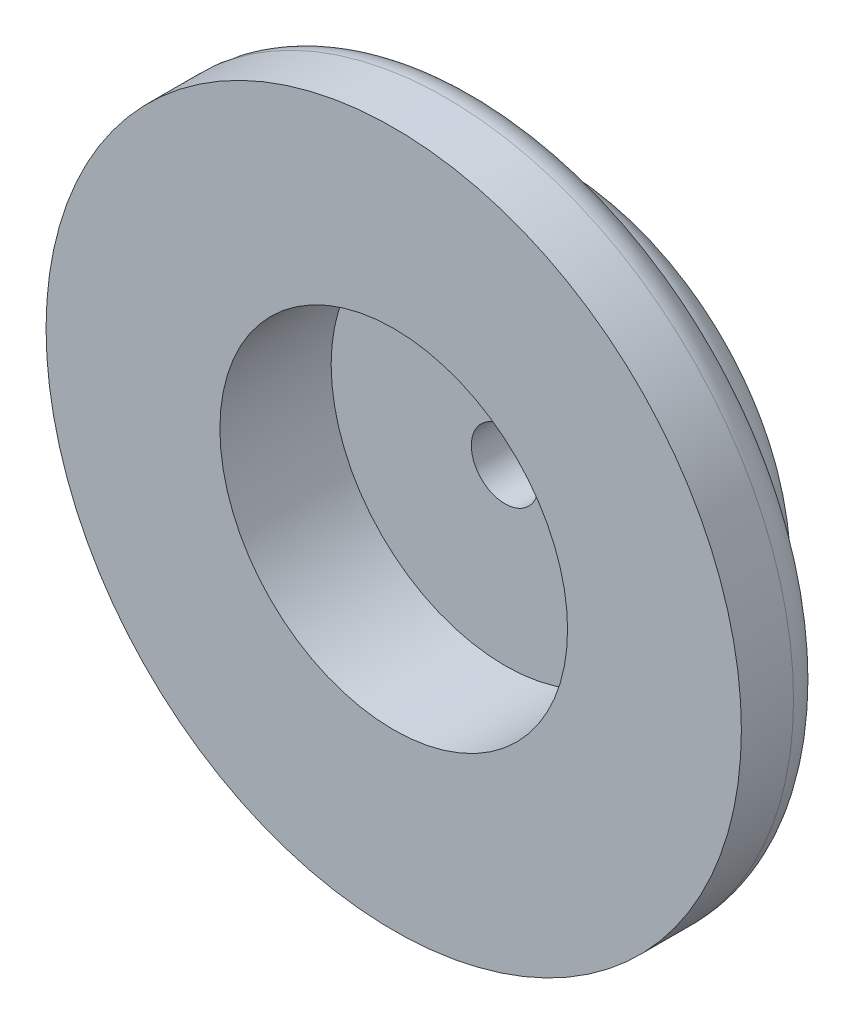
from build123d import *

# Parameters (mm, degrees)
FILLET1_R                        = 2.54
F_10_0_1935_DIAMETER_HOLE1_D     = 4.9149
F_10_0_1935_DIAMETER_HOLE1_DEPTH = 10.16
F_10_0_1935_DIAMETER_HOLE1_TIP   = 1.476584928


with BuildPart() as part:
    # Sketch1 → Revolve1 (revolve)
    with BuildSketch(Plane(origin=(0, 0, 0), x_dir=(0, 0, -1), z_dir=(1, 0, 0)), mode=Mode.PRIVATE) as revolve1_sk:
        Polygon((79.248, 12.7), (79.248, 25.4), (85.598, 25.4), (85.598, 17.78), (91.948, 17.78), (91.948, 0), (87.376, 0), (87.376, 12.7), align=None)
    revolve(revolve1_sk.sketch.rotate(Axis((0, 0, 0), (0, 0, -1)), 90), axis=Axis((0, 0, 0), (0, 0, -1)))

    # Fillet1
    fillet1_edges = [part.edges().sort_by_distance(p)[0] for p in [
        (-17.78, 0, -91.948),
        (-17.78, 0, -85.598),
        (-25.4, 0, -85.598),
    ]]
    fillet(fillet1_edges, radius=FILLET1_R)

    # #10 (0.1935) Diameter Hole1
    with Locations(Plane(origin=(0, 0, -91.948), x_dir=(-1, 0, 0), z_dir=(0, 0, -1))):
        with Locations((0, 0)):
            Hole(F_10_0_1935_DIAMETER_HOLE1_D / 2, depth=F_10_0_1935_DIAMETER_HOLE1_DEPTH)
            with Locations((0, 0, -(F_10_0_1935_DIAMETER_HOLE1_DEPTH + F_10_0_1935_DIAMETER_HOLE1_TIP / 2))):  # 118° drill point
                Cone(0, F_10_0_1935_DIAMETER_HOLE1_D / 2, F_10_0_1935_DIAMETER_HOLE1_TIP, mode=Mode.SUBTRACT)


solid = part.part
